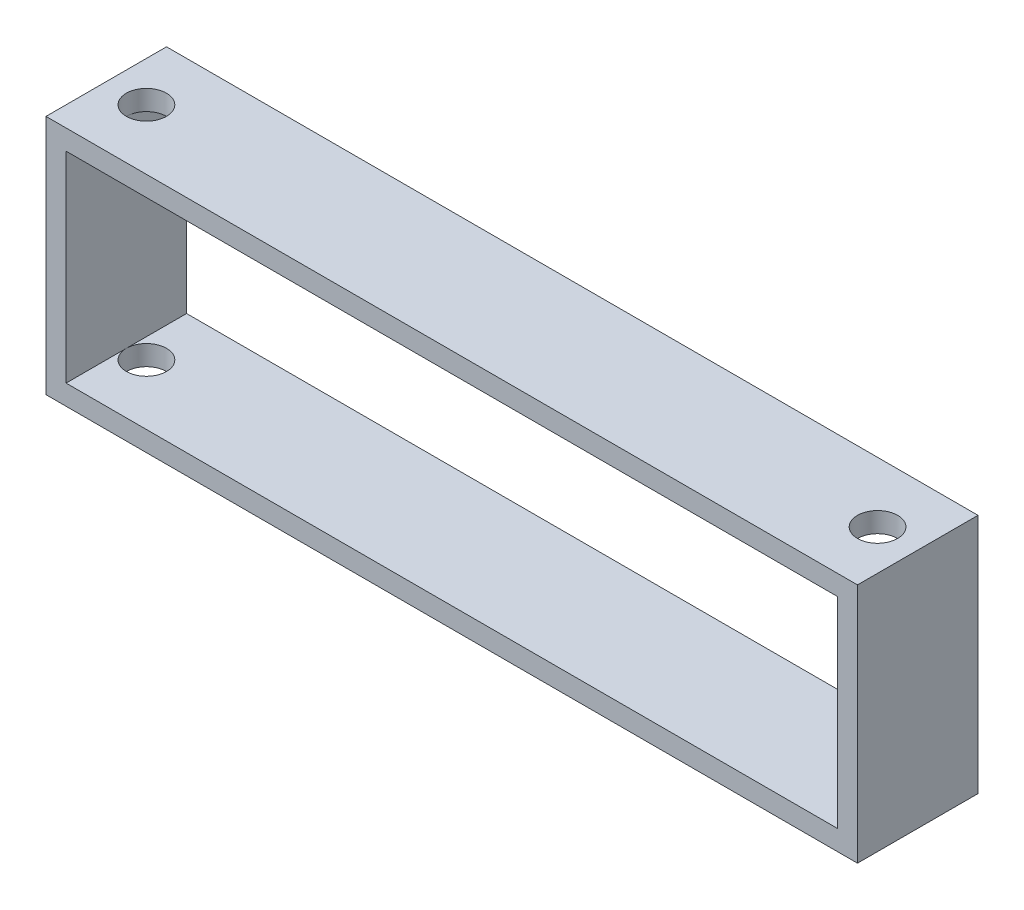
from build123d import *

# Parameters (mm, degrees)
CROQUIS1_W              = 202
CROQUIS1_H              = 30
CROQUIS1_R              = 5
SALIENTE_EXTRUIR1_DEPTH = 60
CROQUIS2_W              = 192
CROQUIS2_H              = 50
CORTAR_EXTRUIR1_DEPTH   = 169.836501235


with BuildPart() as part:
    # Croquis1 → Saliente-Extruir1 (new body)
    with BuildSketch(Plane(origin=(0, 0, 0), x_dir=(1, 0, 0), z_dir=(0, 1, 0))):
        with Locations((53.937936443, 4.098360656)):
            Rectangle(CROQUIS1_W, CROQUIS1_H)
        with Locations(Location((-37.062063557, 4.098360656, 0), (0, 0, 270))):
            Circle(CROQUIS1_R, mode=Mode.SUBTRACT)
        with Locations(Location((144.937936443, 4.098360656, 0), (0, 0, 270))):
            Circle(CROQUIS1_R, mode=Mode.SUBTRACT)
    extrude(amount=SALIENTE_EXTRUIR1_DEPTH)

    # Croquis2 → Cortar-Extruir1 (cut, through all)
    with BuildSketch(Plane.XY.offset(10.901639344)):
        with Locations((53.937936443, 30)):
            Rectangle(CROQUIS2_W, CROQUIS2_H)
    extrude(amount=-CORTAR_EXTRUIR1_DEPTH, mode=Mode.SUBTRACT)


solid = part.part
